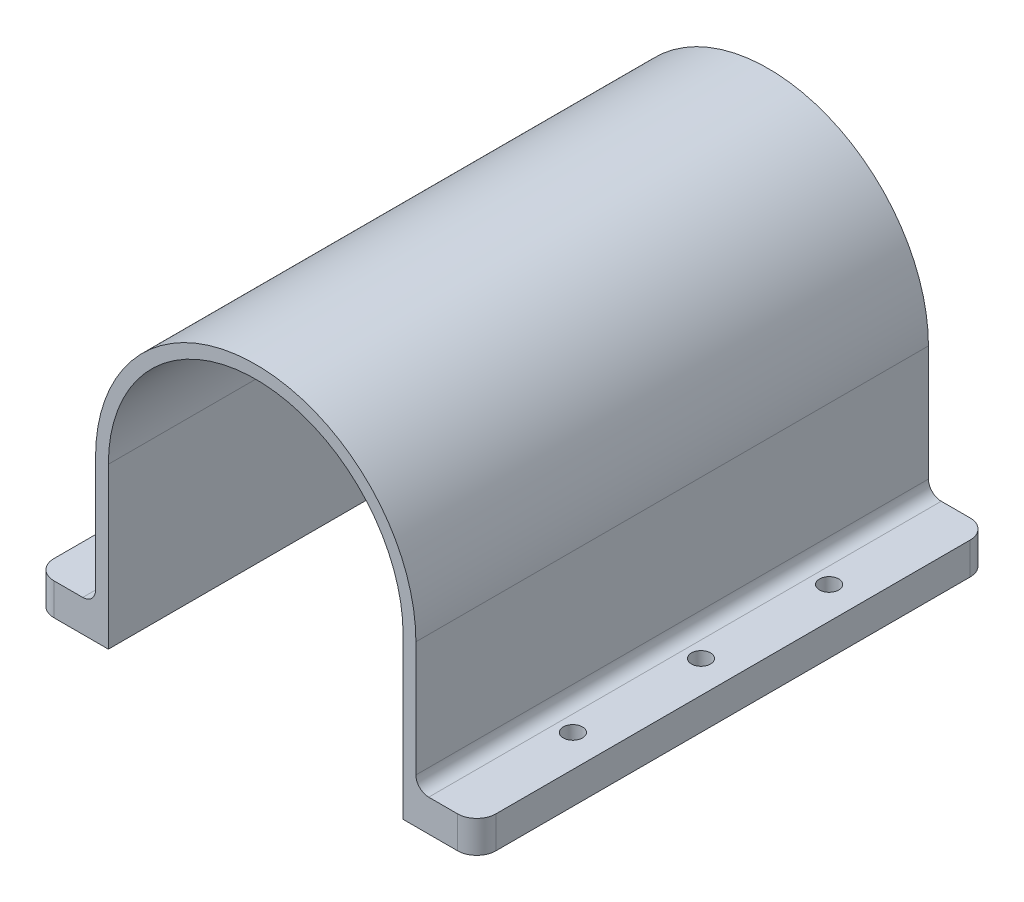
from build123d import *

# Parameters (mm, degrees)
SKETCH1_R               = 2
SKETCH1_R_2             = 13
BOSS_EXTRUDE1_DEPTH     = 80
CUT_EXTRUDE1_DEPTH      = 75
CUT_EXTRUDE2_DEPTH      = 99.05738116
CUT_EXTRUDE2_DEPTH_BACK = 99.05738116
SKETCH3_R               = 1.5
FILLET3_R               = 2
FILLET2_R               = 3


with BuildPart() as part:
    # Sketch1 → Boss-Extrude1 (new body)
    with BuildSketch(Plane.XY):
        with BuildLine():
            Line((-25, 0), (-25, -20))
            Line((-25, -20), (-34.5, -20))
            Line((-34.5, -20), (-34.5, -25))
            Line((-34.5, -25), (34.5, -25))
            Line((34.5, -25), (34.5, -20))
            Line((34.5, -20), (25, -20))
            Line((25, -20), (25, 0))
            ThreePointArc((25, 0), (0, 25), (-25, 0))
        make_face()
        with Locations((-12.40972401, 12.40972401)):
            Circle(SKETCH1_R, mode=Mode.SUBTRACT)
        with Locations((12.40972401, 12.40972401)):
            Circle(SKETCH1_R, mode=Mode.SUBTRACT)
        with Locations((12.40972401, -12.40972401)):
            Circle(SKETCH1_R, mode=Mode.SUBTRACT)
        with Locations((-12.40972401, -12.40972401)):
            Circle(SKETCH1_R, mode=Mode.SUBTRACT)
        Circle(SKETCH1_R_2, mode=Mode.SUBTRACT)
    extrude(amount=BOSS_EXTRUDE1_DEPTH)

    # Sketch2 → Cut-Extrude1 (cut)
    with BuildSketch(Plane.XY.offset(80)):
        with BuildLine():
            Line((-23, 0), (-23, -25))
            Line((-23, -25), (23, -25))
            Line((23, -25), (23, 0))
            ThreePointArc((23, 0), (0, 23), (-23, 0))
        make_face()
    extrude(amount=-CUT_EXTRUDE1_DEPTH, mode=Mode.SUBTRACT)

    # Sketch3 → Cut-Extrude2 (cut, two sides: drawn at the far end of the back side and taken through both)
    with BuildSketch(Plane(origin=(0, -20, 0), x_dir=(1, 0, 0), z_dir=(0, 1, 0)).offset(-CUT_EXTRUDE2_DEPTH_BACK)):
        with Locations(Location((29.5, -40, 0), (0, 0, 270))):
            Circle(SKETCH3_R)
        with Locations(Location((29.5, -60, 0), (0, 0, 270))):
            Circle(SKETCH3_R)
        with Locations(Location((29.5, -20, 0), (0, 0, 270))):
            Circle(SKETCH3_R)
        with Locations(Location((-29.5, -60, 0), (0, 0, 90))):
            Circle(SKETCH3_R)
        with Locations(Location((-29.5, -40, 0), (0, 0, 90))):
            Circle(SKETCH3_R)
        with Locations(Location((-29.5, -20, 0), (0, 0, 90))):
            Circle(SKETCH3_R)
    extrude(amount=CUT_EXTRUDE2_DEPTH + CUT_EXTRUDE2_DEPTH_BACK, mode=Mode.SUBTRACT)

    # Fillet3
    fillet3_edges = [part.edges().sort_by_distance(p)[0] for p in [
        (25, -20, 40),
        (-25, -20, 40),
    ]]
    fillet(fillet3_edges, radius=FILLET3_R)

    # Fillet2
    fillet2_edges = [part.edges().sort_by_distance(p)[0] for p in [
        (-34.5, -22.5, 0),
        (-34.5, -22.5, 80),
        (34.5, -22.5, 80),
        (34.5, -22.5, 0),
    ]]
    fillet(fillet2_edges, radius=FILLET2_R)


solid = part.part
